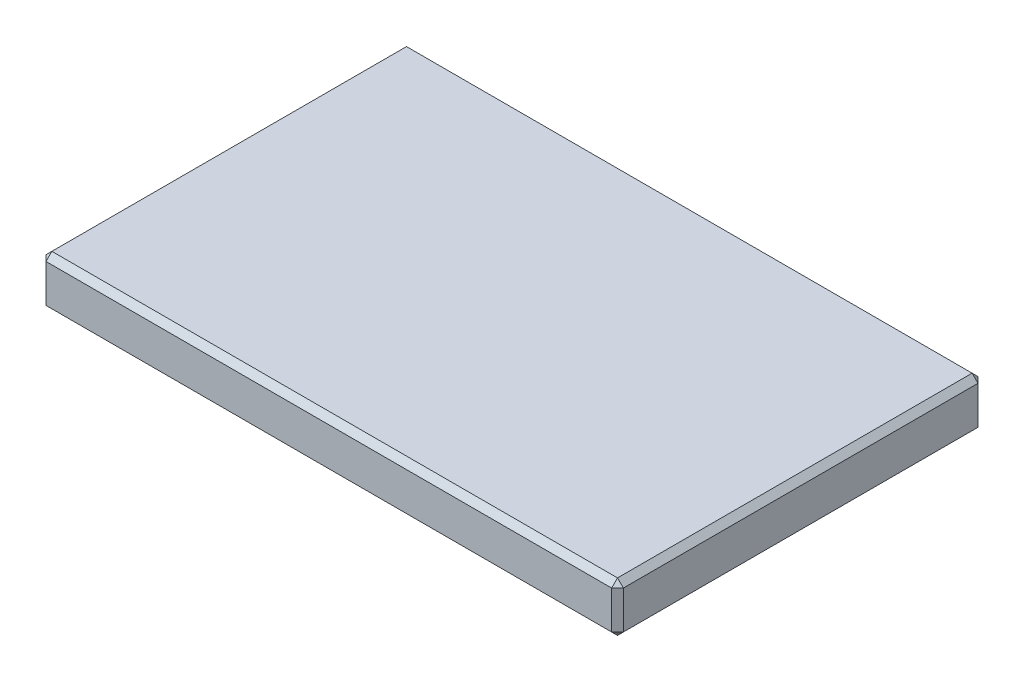
from build123d import *

# Parameters (mm, degrees)
SCHIZZO1_W                   = 197
SCHIZZO1_H                   = 125
ESTRUSIONE_ESTRUSIONE1_DEPTH = 17
SMUSSO1_SIZE                 = 2


with BuildPart() as part:
    # Schizzo1 → Estrusione-Estrusione1 (new body)
    with BuildSketch(Plane(origin=(0, 0, 0), x_dir=(1, 0, 0), z_dir=(0, 1, 0))):
        Rectangle(SCHIZZO1_W, SCHIZZO1_H)
    extrude(amount=ESTRUSIONE_ESTRUSIONE1_DEPTH)

    # Smusso1
    smusso1_edges = [part.edges().sort_by_distance(p)[0] for p in [
        (-98.5, 17, 0),
        (0, 17, 62.5),
        (98.5, 17, 0),
        (0, 0, 62.5),
        (-98.5, 0, 0),
        (0, 0, -62.5),
        (98.5, 0, 0),
        (98.5, 8.5, 62.5),
        (-98.5, 8.5, 62.5),
        (-98.5, 8.5, -62.5),
        (98.5, 8.5, -62.5),
        (0, 17, -62.5),
    ]]
    chamfer(smusso1_edges, length=SMUSSO1_SIZE)


solid = part.part
